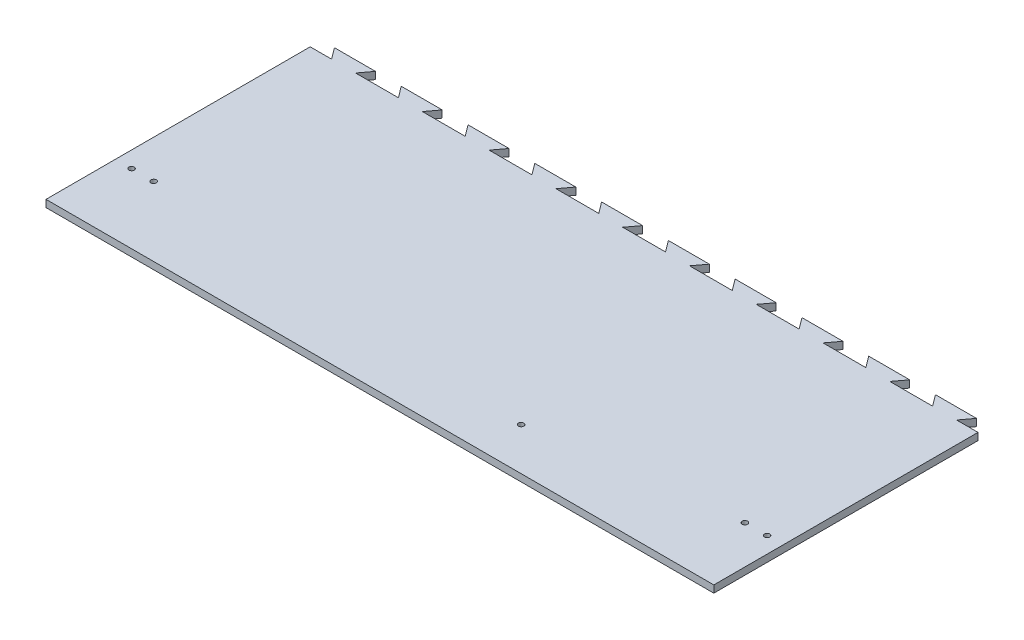
from build123d import *

# Parameters (mm, degrees)
SCHIZZO1_W                   = 558
SCHIZZO1_H                   = 441.5
ESTRUSIONE_ESTRUSIONE1_DEPTH = 6
SCHIZZO2_R                   = 2.25
TAGLIO_ESTRUSIONE1_DEPTH     = 10
TAGLIO_ESTRUSIONE2_DEPTH     = 10


with BuildPart() as part:
    # Schizzo1 → Estrusione-Estrusione1 (new body)
    with BuildSketch(Plane(origin=(0, 0, 0), x_dir=(1, 0, 0), z_dir=(0, 1, 0))):
        Rectangle(SCHIZZO1_W, SCHIZZO1_H)
    extrude(amount=ESTRUSIONE_ESTRUSIONE1_DEPTH)

    # Schizzo2 → Taglio-Estrusione1 (cut)
    with BuildSketch(Plane(origin=(0, 0, 0), x_dir=(-1, 0, 0), z_dir=(0, -1, 0))):
        with Locations(Location((-221, 207.25, 0), (0, 0, 90))):
            Circle(SCHIZZO2_R)
        with Locations(Location((-221, 188.75, 0), (0, 0, 90))):
            Circle(SCHIZZO2_R)
        with Locations(Location((-247, 162.75, 0), (0, 0, 90))):
            Circle(SCHIZZO2_R)
        with Locations(Location((-265.5, 162.75, 0), (0, 0, 90))):
            Circle(SCHIZZO2_R)
        with Locations(Location((221, 207.25, 0), (0, 0, 90))):
            Circle(SCHIZZO2_R)
        with Locations(Location((221, 188.75, 0), (0, 0, 90))):
            Circle(SCHIZZO2_R)
        with Locations(Location((247, 162.75, 0), (0, 0, 90))):
            Circle(SCHIZZO2_R)
        with Locations(Location((265.5, 162.75, 0), (0, 0, 90))):
            Circle(SCHIZZO2_R)
        with Locations(Location((265.5, -162.75, 0), (0, 0, 90))):
            Circle(SCHIZZO2_R)
        with Locations(Location((247, -162.75, 0), (0, 0, 90))):
            Circle(SCHIZZO2_R)
        with Locations(Location((-265.5, -162.75, 0), (0, 0, 90))):
            Circle(SCHIZZO2_R)
        with Locations(Location((-247, -162.75, 0), (0, 0, 90))):
            Circle(SCHIZZO2_R)
        with Locations(Location((-82.5, -185.25, 0), (0, 0, 90))):
            Circle(SCHIZZO2_R)
    extrude(amount=-TAGLIO_ESTRUSIONE1_DEPTH, mode=Mode.SUBTRACT)

    # Schizzo3 → Taglio-Estrusione2 (cut)
    with BuildSketch(Plane(origin=(0, 6, 0), x_dir=(1, 0, 0), z_dir=(0, 1, 0))):
        Polygon((-279, 0), (-261.1, 0), (-268.225, 9.5), (-233.975, 9.5), (-241.1, 0), (-223.2, 0), (-205.3, 0), (-212.425, 9.5), (-178.175, 9.5), (-185.3, 0), (-167.4, 0), (-149.5, 0), (-156.625, 9.5), (-122.375, 9.5), (-129.5, 0), (-111.6, 0), (-93.7, 0), (-100.825, 9.5), (-66.575, 9.5), (-73.7, 0), (-55.8, 0), (-37.9, 0), (-45.025, 9.5), (-10.775, 9.5), (-17.9, 0), (0, 0), (17.9, 0), (10.775, 9.5), (45.025, 9.5), (37.9, 0), (55.8, 0), (73.7, 0), (66.575, 9.5), (100.825, 9.5), (93.7, 0), (111.6, 0), (129.5, 0), (122.375, 9.5), (156.625, 9.5), (149.5, 0), (167.4, 0), (185.3, 0), (178.175, 9.5), (212.425, 9.5), (205.3, 0), (223.2, 0), (241.1, 0), (233.975, 9.5), (268.225, 9.5), (261.1, 0), (279, 0), (279, 220.75), (-279, 220.75), align=None)
    extrude(amount=-TAGLIO_ESTRUSIONE2_DEPTH, mode=Mode.SUBTRACT)


solid = part.part
